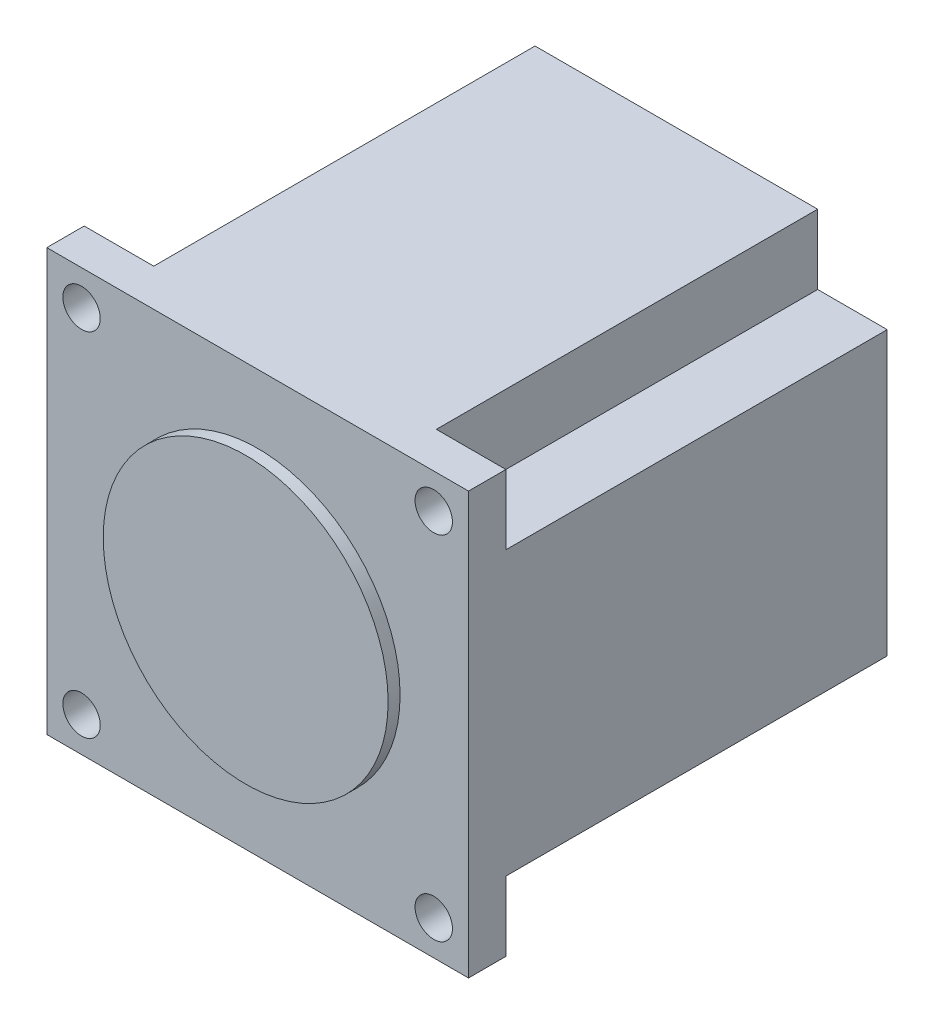
from build123d import *

# Parameters (mm, degrees)
BOSS_EXTRUDE2_DEPTH = 51
SKETCH3_W           = 56.4
SKETCH3_H           = 56.4
SKETCH3_R           = 2.5
BOSS_EXTRUDE3_DEPTH = 5
SKETCH4_R           = 19.05
BOSS_EXTRUDE4_DEPTH = 1.6


with BuildPart() as part:
    # Sketch2 → Boss-Extrude2 (new body)
    with BuildSketch(Plane.XY):
        Polygon((-18.9, 28.2), (18.9, 28.2), (18.9, 18.9), (28.2, 18.9), (28.2, -18.9), (18.9, -18.9), (18.9, -28.2), (-18.9, -28.2), (-18.9, -18.9), (-28.2, -18.9), (-28.2, 18.9), (-18.9, 18.9), align=None)
    extrude(amount=BOSS_EXTRUDE2_DEPTH)

    # Sketch3 → Boss-Extrude3 (add)
    with BuildSketch(Plane.XY.offset(51)):
        Rectangle(SKETCH3_W, SKETCH3_H)
        with Locations((-23.55, 23.55)):
            Circle(SKETCH3_R, mode=Mode.SUBTRACT)
        with Locations((23.55, 23.55)):
            Circle(SKETCH3_R, mode=Mode.SUBTRACT)
        with Locations((23.55, -23.55)):
            Circle(SKETCH3_R, mode=Mode.SUBTRACT)
        with Locations((-23.55, -23.55)):
            Circle(SKETCH3_R, mode=Mode.SUBTRACT)
    extrude(amount=BOSS_EXTRUDE3_DEPTH)

    # Sketch4 → Boss-Extrude4 (add)
    with BuildSketch(Plane.XY.offset(56)):
        with Locations(Location((0, 0, 0), (0, 0, 180))):
            Circle(SKETCH4_R)
    extrude(amount=BOSS_EXTRUDE4_DEPTH)


solid = part.part
